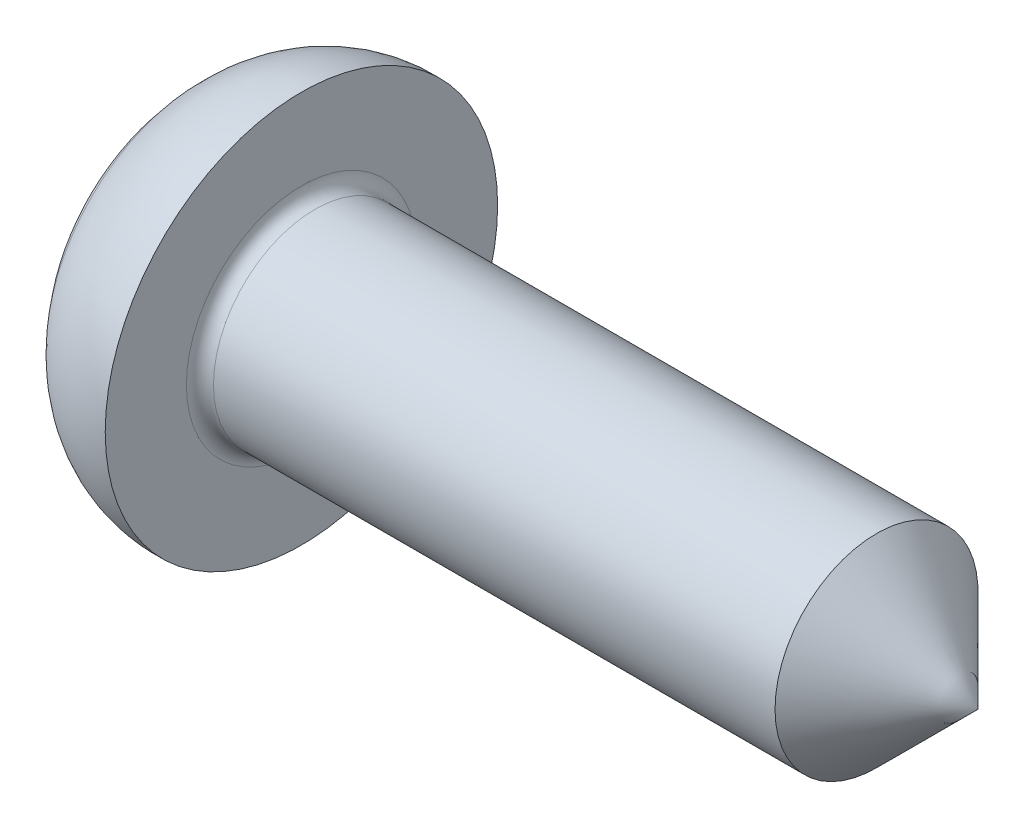
from build123d import *

# Parameters (mm, degrees)
FILLET2_R = 0.2


with BuildPart() as part:
    # Sketch1 → Revolve1 (revolve)
    with BuildSketch(Plane(origin=(0, 0, 0), x_dir=(1, 0, 0), z_dir=(0, 1, 0)), mode=Mode.PRIVATE) as revolve1_sk:
        with BuildLine():
            Line((2.37, 1.5), (12.37, 1.5))
            Line((12.37, 1.5), (12.37, 0))
            Line((12.37, 0), (0, 0))
            ThreePointArc((0, 0), (0.224879408, 1.215980768), (0.869770135, 2.271109163))
            ThreePointArc((0.869770135, 2.271109163), (1.549177667, 2.754228297), (2.37, 2.9))
            Line((2.37, 2.9), (2.37, 1.5))
        make_face()
    revolve(revolve1_sk.sketch.rotate(Axis((-13.629268293, 0, 0), (1, 0, 0)), 180), axis=Axis((-13.629268293, 0, 0), (1, 0, 0)))

    # Fillet2
    fillet2_edges = [part.edges().sort_by_distance(p)[0] for p in [
        (2.37, 0, -1.5),
    ]]
    fillet(fillet2_edges, radius=FILLET2_R)

    # Sketch4 → Cut-Revolve1 (revolve, cut)
    with BuildSketch(Plane(origin=(0, 0, 0), x_dir=(1, 0, 0), z_dir=(0, 1, 0)), mode=Mode.PRIVATE) as cut_revolve1_sk:
        Polygon((13.103454633, 0), (13.103454633, 21), (-8.63, 21), (12.37, 0), align=None)
    revolve(cut_revolve1_sk.sketch.rotate(Axis((4.782773752, 0, 0), (1, 0, 0)), 180), axis=Axis((4.782773752, 0, 0), (1, 0, 0)), mode=Mode.SUBTRACT)

    # Sketch2 → Cut-Loft1 section 0
    with BuildSketch(Plane(origin=(0, 0, 0), x_dir=(0, 0, -1), z_dir=(1, 0, 0)), mode=Mode.PRIVATE) as cut_loft1_s0:
        with BuildLine():
            Line((-0.4625, 0.4625), (-1.85, 0.4625))
            Line((-1.85, 0.4625), (-1.85, -0.4625))
            Line((-1.85, -0.4625), (-0.4625, -0.4625))
            Line((-0.4625, -0.4625), (-0.4625, -1.85))
            Line((-0.4625, -1.85), (0.4625, -1.85))
            Line((0.4625, -1.85), (0.4625, -0.4625))
            Line((0.4625, -0.4625), (1.85, -0.4625))
            Line((1.85, -0.4625), (1.85, 0.4625))
            Line((1.85, 0.4625), (0.4625, 0.4625))
            Line((0.4625, 0.4625), (0.4625, 1.85))
            Line((0.4625, 1.85), (-0.4625, 1.85))
            Line((-0.4625, 1.85), (-0.4625, 0.4625))
        make_face()
    loft([Vertex(2.62, 0, 0), cut_loft1_s0.sketch], mode=Mode.SUBTRACT)


solid = part.part
